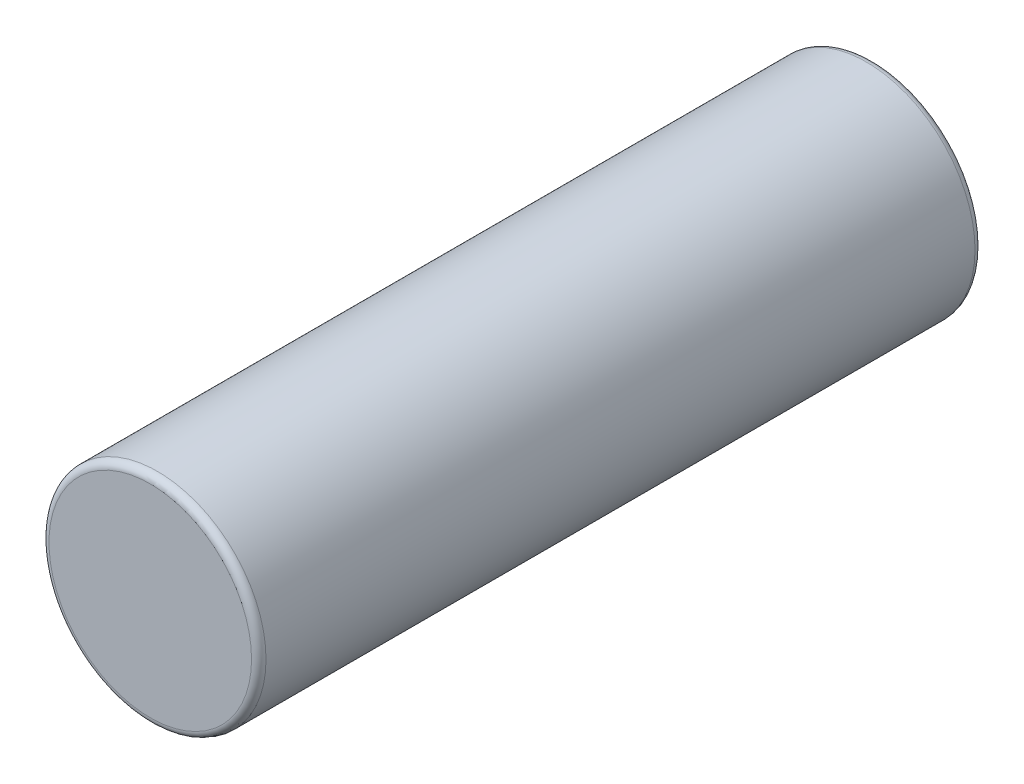
from build123d import *

# Parameters (mm, degrees)
SKETCH_1_R      = 1.5
EXTRUDE_1_DEPTH = 10
FILLET_1_R      = 0.1


with BuildPart() as part:
    # 草图1 → 凸台-拉伸1 (new body)
    with BuildSketch(Plane.XY):
        Circle(SKETCH_1_R)
    extrude(amount=EXTRUDE_1_DEPTH)

    # 圆角1
    fillet_1_edges = [part.edges().sort_by_distance(p)[0] for p in [
        (-1.5, 0, 0),
        (-1.5, 0, 10),
    ]]
    fillet(fillet_1_edges, radius=FILLET_1_R)


solid = part.part
